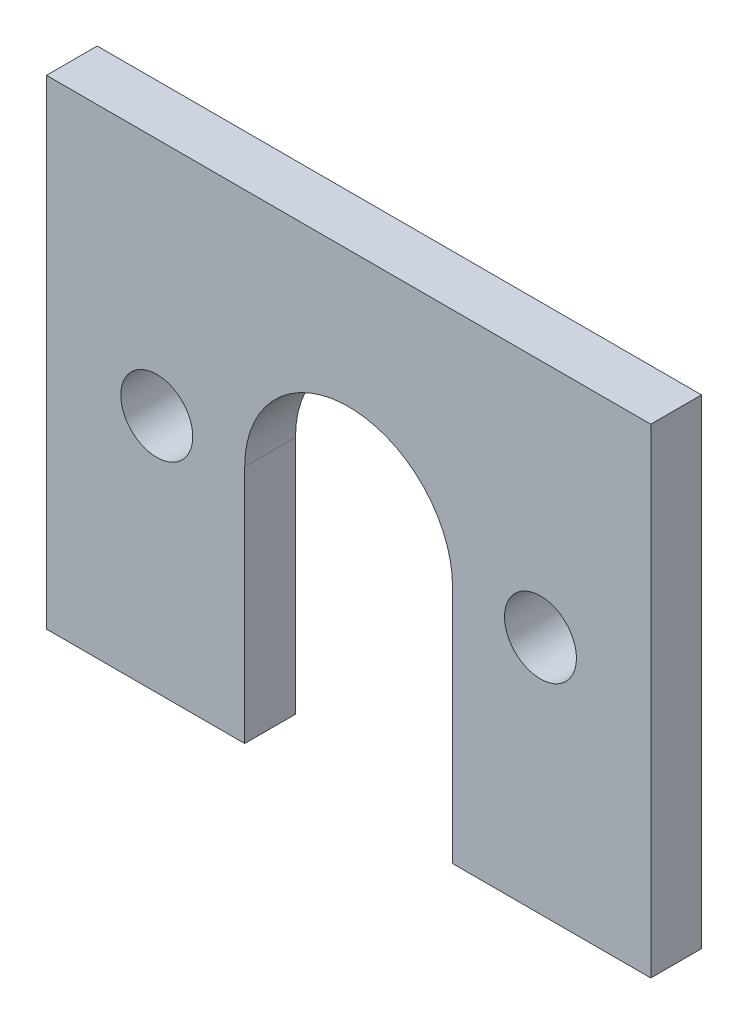
from build123d import *

# Parameters (mm, degrees)
SKETCH1_W            = 299.7
SKETCH1_H            = 76.075
BOSS_EXTRUDE1_DEPTH  = 3.175
CUT_EXTRUDE4_DEPTH   = 155.634907221
SKETCH3_R            = 6.5
CUT_EXTRUDE5_DEPTH   = 155.634907221
M4_CLEARANCE_HOLE1_D = 4.5
SKETCH12_W           = 144
SKETCH12_H           = 3.175
BOSS_EXTRUDE2_DEPTH  = 6.35
SKETCH14_R           = 2.25
SKETCH14_W           = 12.4
SKETCH14_H           = 13.275
CUT_EXTRUDE7_DEPTH   = 157.318115653


with BuildPart() as part:
    # Sketch1 → Boss-Extrude1 (new body)
    with BuildSketch(Plane.XY):
        Rectangle(SKETCH1_W, SKETCH1_H)
    extrude(amount=BOSS_EXTRUDE1_DEPTH)

    # Sketch8 → Cut-Extrude4 (cut, through all)
    with BuildSketch(Plane.XY.offset(3.175)):
        with BuildLine():
            Line((121.65, 18.5125), (123.65, 18.5125))
            ThreePointArc((123.65, 18.5125), (127.185533906, 17.048033906), (128.65, 13.5125))
            Line((128.65, 13.5125), (128.65, -27.282435401))
            ThreePointArc((128.65, -27.282435401), (127.185533906, -30.817969307), (123.65, -32.282435401))
            Line((123.65, -32.282435401), (121.65, -32.282435401))
            ThreePointArc((121.65, -32.282435401), (118.114466094, -30.817969307), (116.65, -27.282435401))
            Line((116.65, -27.282435401), (116.65, 13.5125))
            ThreePointArc((116.65, 13.5125), (118.114466094, 17.048033906), (121.65, 18.5125))
        make_face()
        with BuildLine():
            Line((128.65, -38.0375), (128.65, -27.282435401))
            ThreePointArc((128.65, -27.282435401), (127.185533906, -30.817969307), (123.65, -32.282435401))
            Line((123.65, -32.282435401), (121.65, -32.282435401))
            ThreePointArc((121.65, -32.282435401), (118.114466094, -30.817969307), (116.65, -27.282435401))
            Line((116.65, -27.282435401), (116.65, -38.0375))
            Line((116.65, -38.0375), (128.65, -38.0375))
        make_face()
    cut_extrude4 = extrude(amount=-CUT_EXTRUDE4_DEPTH, mode=Mode.SUBTRACT)

    # Mirror3: Cut-Extrude4 across plane
    add(cut_extrude4.mirror(Plane(origin=(0, 0, 0), x_dir=(0, 0, 1), z_dir=(1, 0, 0))), mode=Mode.SUBTRACT)

    # Sketch3 → Cut-Extrude5 (cut, through all)
    with BuildSketch(Plane(origin=(0, 0, 0), x_dir=(-1, 0, 0), z_dir=(0, 0, -1))):
        with Locations((-97.75, -9.7625)):
            Circle(SKETCH3_R)
        with BuildLine():
            Line((-104.25, -38.0375), (-91.25, -38.0375))
            Line((-91.25, -38.0375), (-91.25, -9.7625))
            ThreePointArc((-91.25, -9.7625), (-97.75, -16.2625), (-104.25, -9.7625))
            Line((-104.25, -9.7625), (-104.25, -38.0375))
        make_face()
        with Locations((97.75, -9.7625)):
            Circle(SKETCH3_R)
        with BuildLine():
            Line((91.25, -38.0375), (104.25, -38.0375))
            Line((104.25, -38.0375), (104.25, -9.7625))
            ThreePointArc((104.25, -9.7625), (97.75, -16.2625), (91.25, -9.7625))
            Line((91.25, -9.7625), (91.25, -38.0375))
        make_face()
    extrude(amount=-CUT_EXTRUDE5_DEPTH, mode=Mode.SUBTRACT)

    # M4 Clearance Hole1 (through all)
    with Locations(Plane(origin=(0, 0, 0), x_dir=(-1, 0, 0), z_dir=(0, 0, -1))):
        with Locations((-85.75, -9.7625), (-109.75, -9.7625), (109.75, -9.7625), (85.75, -9.7625)):
            Hole(M4_CLEARANCE_HOLE1_D / 2)

    # Sketch12 → Boss-Extrude2 (add)
    with BuildSketch(Plane.XZ.offset(38.0375)):
        with Locations((0, 1.5875)):
            Rectangle(SKETCH12_W, SKETCH12_H)
    extrude(amount=BOSS_EXTRUDE2_DEPTH)

    # Sketch14 → Cut-Extrude7 (cut, through all)
    # profile 1 of 2: a face of its own
    with BuildSketch(Plane.XY.offset(3.175)):
        with BuildLine():
            Line((-78.85, -24.7625), (-91.25, -24.7625))
            Line((-91.25, -24.7625), (-91.25, -38.0375))
            Line((-91.25, -38.0375), (-72, -38.0375))
            Line((-72, -38.0375), (-72, -44.3875))
            Line((-72, -44.3875), (72, -44.3875))
            Line((72, -44.3875), (72, -38.0375))
            Line((72, -38.0375), (91.25, -38.0375))
            Line((91.25, -38.0375), (91.25, -9.7625))
            ThreePointArc((91.25, -9.7625), (97.75, -3.2625), (104.25, -9.7625))
            Line((104.25, -9.7625), (104.25, -38.0375))
            Line((104.25, -38.0375), (116.65, -38.0375))
            Line((116.65, -38.0375), (116.65, 13.5125))
            ThreePointArc((116.65, 13.5125), (118.114466094, 17.048033906), (121.65, 18.5125))
            Line((121.65, 18.5125), (123.65, 18.5125))
            ThreePointArc((123.65, 18.5125), (127.185533906, 17.048033906), (128.65, 13.5125))
            Line((128.65, 13.5125), (128.65, -38.0375))
            Line((128.65, -38.0375), (149.85, -38.0375))
            Line((149.85, -38.0375), (149.85, 38.0375))
            Line((149.85, 38.0375), (-149.85, 38.0375))
            Line((-149.85, 38.0375), (-149.85, -38.0375))
            Line((-149.85, -38.0375), (-128.65, -38.0375))
            Line((-128.65, -38.0375), (-128.65, 13.5125))
            ThreePointArc((-128.65, 13.5125), (-127.185533906, 17.048033906), (-123.65, 18.5125))
            Line((-123.65, 18.5125), (-121.65, 18.5125))
            ThreePointArc((-121.65, 18.5125), (-118.114466094, 17.048033906), (-116.65, 13.5125))
            Line((-116.65, 13.5125), (-116.65, 5.2375))
            Line((-116.65, 5.2375), (-78.85, 5.2375))
            Line((-78.85, 5.2375), (-78.85, -24.7625))
        make_face()
        with Locations((85.75, -9.7625)):
            Circle(SKETCH14_R, mode=Mode.SUBTRACT)
        with Locations((109.75, -9.7625)):
            Circle(SKETCH14_R, mode=Mode.SUBTRACT)
    # profile 2 of 2: a face of its own
    with BuildSketch(Plane.XY.offset(3.175)):
        with Locations((-110.45, -31.4)):
            Rectangle(SKETCH14_W, SKETCH14_H)
    extrude(amount=-CUT_EXTRUDE7_DEPTH, mode=Mode.SUBTRACT)


solid = part.part
